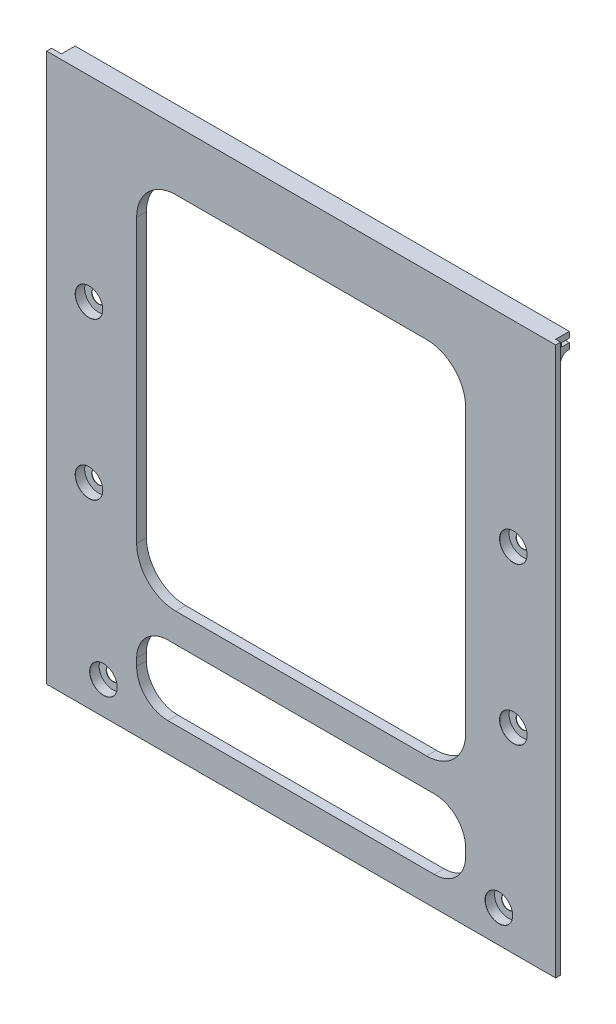
from build123d import *

# Parameters (mm, degrees)
ESBO_O1_W                                      = 130
ESBO_O1_H                                      = 140.05
RESSALTO_EXTRUS_O1_DEPTH                       = 2.5
ESBO_O2_W                                      = 130
ESBO_O2_H                                      = 4
RESSALTO_EXTRUS_O2_DEPTH                       = 2.25
FILETE1_R                                      = 2
ESBO_O3_W                                      = 130
ESBO_O3_H                                      = 1
CORTE_EXTRUS_O1_DEPTH                          = 2
ESBO_O6_W                                      = 1.25
ESBO_O6_H                                      = 140.05
CORTE_EXTRUS_O2_DEPTH                          = 3.5
ESBO_O8_W                                      = 1.25
ESBO_O8_H                                      = 3.5
CORTE_EXTRUS_O3_DEPTH                          = 6.25
REBAIXO_PARA_PARAFUSO_COM_CABE_A_PAN_2_COUNT   = 2
REBAIXO_PARA_PARAFUSO_COM_CABE_A_PAN_2_PITCH   = 40
REBAIXO_PARA_PARAFUSO_COM_CABE_A_PAN_3_COUNT   = 2
REBAIXO_PARA_PARAFUSO_COM_CABE_A_PAN_3_PITCH   = 108.4
REBAIXO_PARA_PARAFUSO_COM_CABE_A_PAN_4_COUNT   = 2
REBAIXO_PARA_PARAFUSO_COM_CABE_A_PAN_4_PITCH   = 115.544623415
CORTE_EXTRUS_O5_DEPTH                          = 8.25
REBAIXO_PARA_PARAFUSO_COM_CABE_A_PAN_5_A_COUNT = 2
REBAIXO_PARA_PARAFUSO_COM_CABE_A_PAN_5_A_PITCH = 101


with BuildPart() as part:
    # Esboço1 → Ressalto-extrusão1 (new body)
    with BuildSketch(Plane.XY):
        with Locations((0.510662177, -29.099074074)):
            Rectangle(ESBO_O1_W, ESBO_O1_H)
    extrude(amount=RESSALTO_EXTRUS_O1_DEPTH)

    # Esboço2 → Ressalto-extrusão2 (add)
    with BuildSketch(Plane(origin=(0, 0, 0), x_dir=(-1, 0, 0), z_dir=(0, 0, -1))):
        with Locations((-0.510662177, 38.925925926)):
            Rectangle(ESBO_O2_W, ESBO_O2_H)
    extrude(amount=RESSALTO_EXTRUS_O2_DEPTH)

    # Filete1
    filete1_edges = [part.edges().sort_by_distance(p)[0] for p in [
        (0.510662177, 36.925925926, 0),
    ]]
    fillet(filete1_edges, radius=FILETE1_R)

    # Esboço3 → Corte-extrusão1 (cut)
    with BuildSketch(Plane(origin=(0, 0, -2.25), x_dir=(-1, 0, 0), z_dir=(0, 0, -1))):
        with Locations((-0.510662177, 38.925925926)):
            Rectangle(ESBO_O3_W, ESBO_O3_H)
    extrude(amount=-CORTE_EXTRUS_O1_DEPTH, mode=Mode.SUBTRACT)

    # Esboço6 → Corte-extrusão2 (cut)
    with BuildSketch(Plane(origin=(0, 0, -2.25), x_dir=(-1, 0, 0), z_dir=(0, 0, -1))):
        with Locations((-64.885662177, -29.099074074)):
            Rectangle(ESBO_O6_W, ESBO_O6_H)
        with Locations((63.864337823, -29.099074074)):
            Rectangle(ESBO_O6_W, ESBO_O6_H)
    extrude(amount=-CORTE_EXTRUS_O2_DEPTH, mode=Mode.SUBTRACT)

    # Esboço8 → Corte-extrusão3 (cut)
    with BuildSketch(Plane(origin=(0, 40.925925926, 0), x_dir=(1, 0, 0), z_dir=(0, 1, 0))):
        with Locations((-62.614337823, 0.5)):
            Rectangle(ESBO_O8_W, ESBO_O8_H)
    extrude(amount=-CORTE_EXTRUS_O3_DEPTH, mode=Mode.SUBTRACT)

    # Esboço12 → Rebaixo para parafuso com cabe_a panela (revolve, cut)
    with BuildSketch(Plane(origin=(-53.689337823, -9.124074074, 2.5), x_dir=(0, -1, 0), z_dir=(1, 0, 0))):
        Polygon((0, 0), (0, 4.75), (1.7, 4.75), (1.7, 2.4), (3.5, 2.4), (3.5, 0.025), (3.525, 0), align=None)
    rebaixo_para_parafuso_com_cabe_a_panela = revolve(axis=Axis((-53.689337823, -9.124074074, 8.85), (0, 0, -1)), mode=Mode.SUBTRACT)

    # Rebaixo para parafuso com cabe_a pan 2: Rebaixo para parafuso com cabe_a panela ×2
    with Locations(*[(0, -i * REBAIXO_PARA_PARAFUSO_COM_CABE_A_PAN_2_PITCH, 0) for i in range(1, REBAIXO_PARA_PARAFUSO_COM_CABE_A_PAN_2_COUNT)]):
        add(rebaixo_para_parafuso_com_cabe_a_panela, mode=Mode.SUBTRACT)

    # Rebaixo para parafuso com cabe_a pan 3: Rebaixo para parafuso com cabe_a panela ×2
    with Locations(*[(i * REBAIXO_PARA_PARAFUSO_COM_CABE_A_PAN_3_PITCH, 0, 0) for i in range(1, REBAIXO_PARA_PARAFUSO_COM_CABE_A_PAN_3_COUNT)]):
        add(rebaixo_para_parafuso_com_cabe_a_panela, mode=Mode.SUBTRACT)

    # Rebaixo para parafuso com cabe_a pan 4: Rebaixo para parafuso com cabe_a panela ×2
    with Locations(*[Vector(0.9381656783035653, -0.3461865971599872, 0) * (i * REBAIXO_PARA_PARAFUSO_COM_CABE_A_PAN_4_PITCH) for i in range(1, REBAIXO_PARA_PARAFUSO_COM_CABE_A_PAN_4_COUNT)]):
        add(rebaixo_para_parafuso_com_cabe_a_panela, mode=Mode.SUBTRACT)

    # Esboço13 → Corte-extrusão5 (cut)
    with BuildSketch(Plane.XY.offset(2.5)):
        with BuildLine():
            Line((32.535999817, -66.48621762), (-31.514675462, -66.48621762))
            ThreePointArc((-31.514675462, -66.48621762), (-38.585743274, -63.557285432), (-41.514675462, -56.48621762))
            Line((-41.514675462, -56.48621762), (-41.514675462, 15.639195022))
            ThreePointArc((-41.514675462, 15.639195022), (-38.585743274, 22.710262834), (-31.514675462, 25.639195022))
            Line((-31.514675462, 25.639195022), (32.535999817, 25.639195022))
            ThreePointArc((32.535999817, 25.639195022), (39.607067629, 22.710262834), (42.535999817, 15.639195022))
            Line((42.535999817, 15.639195022), (42.535999817, -56.48621762))
            ThreePointArc((42.535999817, -56.48621762), (39.607067629, -63.557285432), (32.535999817, -66.48621762))
        make_face()
        with BuildLine():
            Line((34.535999817, -91.70501851), (-33.514675462, -91.70501851))
            ThreePointArc((-33.514675462, -91.70501851), (-39.171529712, -89.361872759), (-41.514675462, -83.70501851))
            Line((-41.514675462, -83.70501851), (-41.514675462, -81.880603518))
            ThreePointArc((-41.514675462, -81.880603518), (-39.171529712, -76.223749269), (-33.514675462, -73.880603518))
            Line((-33.514675462, -73.880603518), (34.535999817, -73.880603518))
            ThreePointArc((34.535999817, -73.880603518), (40.192854066, -76.223749269), (42.535999817, -81.880603518))
            Line((42.535999817, -81.880603518), (42.535999817, -83.70501851))
            ThreePointArc((42.535999817, -83.70501851), (40.192854066, -89.361872759), (34.535999817, -91.70501851))
        make_face()
    extrude(amount=-CORTE_EXTRUS_O5_DEPTH, mode=Mode.SUBTRACT)

    # Esboço16 → Rebaixo para parafuso com cabe_a pan 5 (revolve, cut)
    with BuildSketch(Plane(origin=(-49.989337823, -90.824074074, 2.5), x_dir=(0, -1, 0), z_dir=(1, 0, 0))):
        Polygon((0, 0), (0, 4.75), (1.7, 4.75), (1.7, 2.4), (3.5, 2.4), (3.5, 0.025), (3.525, 0), align=None)
    rebaixo_para_parafuso_com_cabe_a_pan_5 = revolve(axis=Axis((-49.989337823, -90.824074074, 8.85), (0, 0, -1)), mode=Mode.SUBTRACT)

    # Rebaixo para parafuso com cabe_a pan 5 a: Rebaixo para parafuso com cabe_a pan 5 ×2
    with Locations(*[(i * REBAIXO_PARA_PARAFUSO_COM_CABE_A_PAN_5_A_PITCH, 0, 0) for i in range(1, REBAIXO_PARA_PARAFUSO_COM_CABE_A_PAN_5_A_COUNT)]):
        add(rebaixo_para_parafuso_com_cabe_a_pan_5, mode=Mode.SUBTRACT)


solid = part.part
